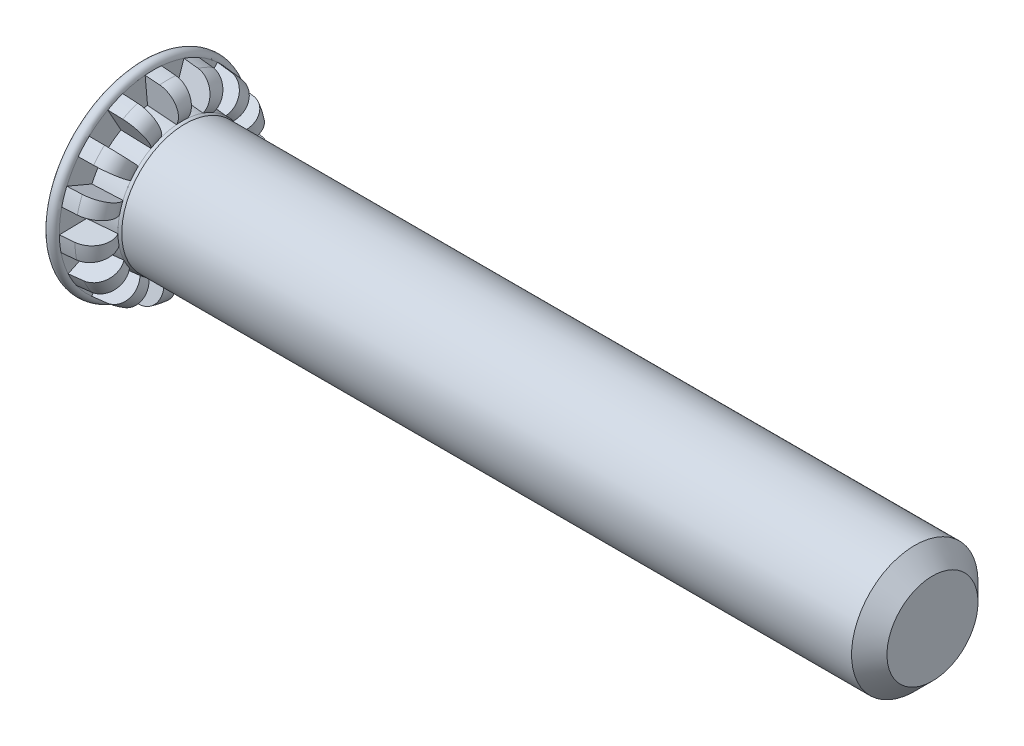
from build123d import *

# Parameters (mm, degrees)
BOSS_EXTRUDE1_START = 12.5
SKETCH2_R           = 2
BOSS_EXTRUDE1_DEPTH = 25
REVOLVE2_ANGLE      = 10
CIRPATTERN1_COUNT   = 15
CHAMFER1_SIZE       = 0.56


with BuildPart() as part:
    # Sketch2 → Boss-Extrude1 (new body)
    with BuildSketch(Plane(origin=(0, 0, 0), x_dir=(0, 0, -1), z_dir=(1, 0, 0)).offset(BOSS_EXTRUDE1_START)):
        Circle(SKETCH2_R)
    extrude(amount=-BOSS_EXTRUDE1_DEPTH)

    # Sketch5 → Revolve1 (revolve)
    with BuildSketch(Plane.XY, mode=Mode.PRIVATE) as revolve1_sk:
        with BuildLine():
            Line((-12.5, 0), (-12.5, 2.975))
            ThreePointArc((-12.5, 2.975), (-12.325, 3.15), (-12.15, 2.975))
            Line((-12.15, 2.975), (-12.15, 2.110172817))
            Line((-12.15, 2.110172817), (-11.240028773, 2.03056065))
            ThreePointArc((-11.240028773, 2.03056065), (-11.15, 2), (-11.084254841, 1.931321711))
            Line((-11.084254841, 1.931321711), (-9.969205731, 0))
            Line((-9.969205731, 0), (-12.5, 0))
        make_face()
    revolve(revolve1_sk.sketch.rotate(Axis((-12.5, 0, 0), (1, 0, 0)), 180), axis=Axis((-12.5, 0, 0), (1, 0, 0)))

    # Sketch6 → Revolve2 (revolve, symmetric)
    with BuildSketch(Plane.XY) as revolve2_sk:
        with BuildLine():
            Line((-12.15, 2.975), (-12.15, 0))
            Line((-12.15, 0), (-11.240028773, 0))
            Line((-11.240028773, 0), (-11.240028773, 2.03056065))
            ThreePointArc((-11.240028773, 2.03056065), (-11.215248765, 2.609757983), (-11.695014387, 2.935193917))
            Line((-11.695014387, 2.935193917), (-12.15, 2.975))
        make_face()
    revolve(axis=Axis((-12.15, 0, 0), (1, 0, 0)), revolution_arc=REVOLVE2_ANGLE / 2)
    revolve(revolve2_sk.sketch, axis=Axis((-12.15, 0, 0), (-1, 0, 0)), revolution_arc=REVOLVE2_ANGLE / 2)

    # CirPattern1: part ×15 about axis
    cirpattern1_axis = Axis((0, 0, 0), (1, 0, 0))


with BuildPart() as part_1:
    add(part.part)
    for i in range(1, CIRPATTERN1_COUNT):
        add(part.part.rotate(cirpattern1_axis, i * 360 / CIRPATTERN1_COUNT))

    # Chamfer1
    chamfer1_edges = [part_1.edges().sort_by_distance(p)[0] for p in [
        (12.5, 0, 2),
    ]]
    chamfer(chamfer1_edges, length=CHAMFER1_SIZE)


solid = part_1.part
